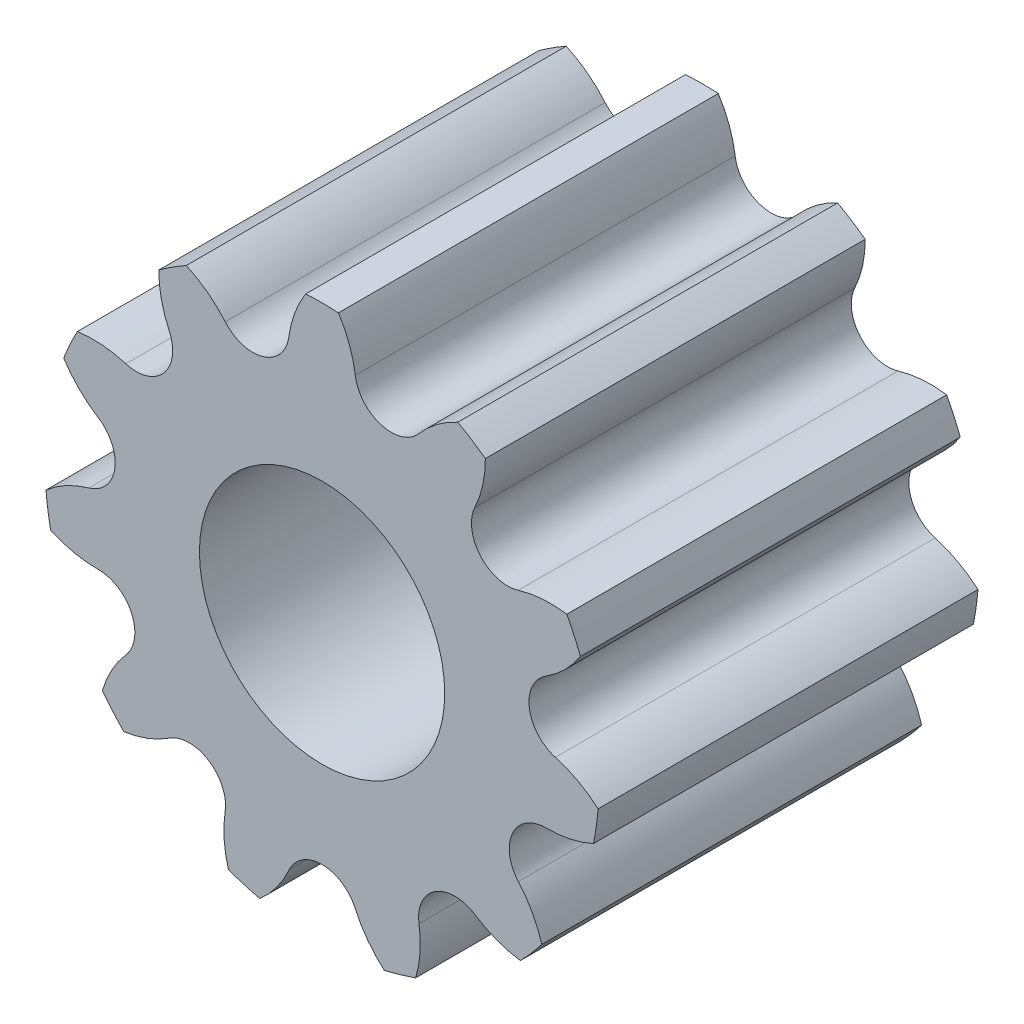
from build123d import *

# Parameters (mm, degrees)
SKETCH1_R           = 1.55
BOSS_EXTRUDE1_DEPTH = 4.8


with BuildPart() as part:
    # Sketch1 → Boss-Extrude1 (new body)
    with BuildSketch(Plane.XY):
        with BuildLine():
            ThreePointArc((-1.220475879, -2.635924597), (-1.222210326, -2.658421079), (-1.225048855, -2.680805064))
            ThreePointArc((-1.225048855, -2.680805064), (-1.237827813, -2.990086384), (-1.183146697, -3.294763611))
            ThreePointArc((-1.183146697, -3.294763611), (-0.986277373, -3.358952263), (-0.785957353, -3.411388925))
            ThreePointArc((-0.785957353, -3.411388925), (-0.575235727, -3.184640974), (-0.418775964, -2.917548145))
            ThreePointArc((-0.418775964, -2.917548145), (-0.409062191, -2.897182914), (-0.398358784, -2.877319956))
            ThreePointArc((-0.398358784, -2.877319956), (0, -2.646063949), (0.398358784, -2.877319957))
            ThreePointArc((0.398358784, -2.877319957), (0.409062191, -2.897182914), (0.418775964, -2.917548145))
            ThreePointArc((0.418775964, -2.917548145), (0.575235727, -3.184640974), (0.785957353, -3.411388925))
            ThreePointArc((0.785957353, -3.411388925), (0.986277373, -3.358952263), (1.183146697, -3.294763611))
            ThreePointArc((1.183146697, -3.294763611), (1.237827812, -2.990086385), (1.225048855, -2.680805065))
            ThreePointArc((1.225048855, -2.680805065), (1.222210326, -2.65842108), (1.220475879, -2.635924598))
            ThreePointArc((1.220475879, -2.635924598), (1.430570178, -2.226010644), (1.890717351, -2.205186558))
            ThreePointArc((1.890717351, -2.205186558), (1.910460355, -2.216109643), (1.929642376, -2.227990303))
            ThreePointArc((1.929642376, -2.227990303), (2.205665989, -2.368094556), (2.505525497, -2.444922359))
            ThreePointArc((2.505525497, -2.444922359), (2.645696022, -2.292508653), (2.776610031, -2.13207413))
            ThreePointArc((2.776610031, -2.13207413), (2.657889767, -1.846200494), (2.479929318, -1.592925316))
            ThreePointArc((2.479929318, -1.592925316), (2.4654397, -1.575629335), (2.451818074, -1.557641803))
            ThreePointArc((2.451818074, -1.557641803), (2.40694443, -1.09921469), (2.782786513, -0.832922011))
            ThreePointArc((2.782786513, -0.832922011), (2.80530085, -0.831437221), (2.827860963, -0.831061285))
            ThreePointArc((2.827860963, -0.831061285), (3.135812881, -0.79969485), (3.429606999, -0.702210219))
            ThreePointArc((3.429606999, -0.702210219), (3.465124877, -0.498209743), (3.488519299, -0.292466177))
            ThreePointArc((3.488519299, -0.292466177), (3.234090501, -0.116158991), (2.947449745, 0.000696964))
            ThreePointArc((2.947449745, 0.000696964), (2.925909389, 0.00741359), (2.904725354, 0.015181258))
            ThreePointArc((2.904725354, 0.015181258), (2.619130834, 0.376574163), (2.791340622, 0.80378939))
            ThreePointArc((2.791340622, 0.80378939), (2.80947815, 0.817210645), (2.828253678, 0.829723821))
            ThreePointArc((2.828253678, 0.829723821), (3.070361342, 1.022602322), (3.264812511, 1.263448704))
            ThreePointArc((3.264812511, 1.263448704), (3.184401067, 1.454267239), (3.092848337, 1.63999772))
            ThreePointArc((3.092848337, 1.63999772), (2.783490351, 1.65076217), (2.479175704, 1.594097963))
            ThreePointArc((2.479175704, 1.594097963), (2.457423521, 1.588102753), (2.435402858, 1.583184377))
            ThreePointArc((2.435402858, 1.583184377), (1.999761704, 1.73280338), (1.913663807, 2.18530334))
            ThreePointArc((1.913663807, 2.18530334), (1.921665988, 2.206399906), (1.930695833, 2.227077476))
            ThreePointArc((1.930695833, 2.227077476), (2.030091771, 2.520230481), (2.063463119, 2.82797159))
            ThreePointArc((2.063463119, 2.82797159), (1.892652419, 2.945024649), (1.715219882, 3.051773929))
            ThreePointArc((1.715219882, 3.051773929), (1.449151682, 2.893578006), (1.223780893, 2.681384122))
            ThreePointArc((1.223780893, 2.681384122), (1.208723048, 2.664580512), (1.192857163, 2.648537642))
            ThreePointArc((1.192857163, 2.648537642), (0.745482362, 2.538879767), (0.428412254, 2.87299892))
            ThreePointArc((0.428412254, 2.87299892), (0.423738452, 2.895072786), (0.420155704, 2.917349768))
            ThreePointArc((0.420155704, 2.917349768), (0.345282406, 3.217703271), (0.206978766, 3.494633479))
            ThreePointArc((0.206978766, 3.494633479), (0.103534673, 3.499226191), (0, 3.500757541))
            ThreePointArc((0, 3.500757541), (-0.103534673, 3.499226191), (-0.206978766, 3.494633479))
            ThreePointArc((-0.206978766, 3.494633479), (-0.345282406, 3.217703271), (-0.420155704, 2.917349768))
            ThreePointArc((-0.420155704, 2.917349768), (-0.423738452, 2.895072786), (-0.428412254, 2.87299892))
            ThreePointArc((-0.428412254, 2.87299892), (-0.745482362, 2.538879767), (-1.192857163, 2.648537642))
            ThreePointArc((-1.192857163, 2.648537642), (-1.208723048, 2.664580512), (-1.223780893, 2.681384122))
            ThreePointArc((-1.223780893, 2.681384122), (-1.449151682, 2.893578006), (-1.715219882, 3.051773929))
            ThreePointArc((-1.715219882, 3.051773929), (-1.892652419, 2.945024649), (-2.063463119, 2.82797159))
            ThreePointArc((-2.063463119, 2.82797159), (-2.030091771, 2.520230481), (-1.930695833, 2.227077476))
            ThreePointArc((-1.930695833, 2.227077476), (-1.921665988, 2.206399906), (-1.913663807, 2.18530334))
            ThreePointArc((-1.913663807, 2.18530334), (-1.999761704, 1.73280338), (-2.435402858, 1.583184377))
            ThreePointArc((-2.435402858, 1.583184377), (-2.457423521, 1.588102753), (-2.479175704, 1.594097963))
            ThreePointArc((-2.479175704, 1.594097963), (-2.783490351, 1.65076217), (-3.092848337, 1.63999772))
            ThreePointArc((-3.092848337, 1.63999772), (-3.184401067, 1.454267239), (-3.264812511, 1.263448704))
            ThreePointArc((-3.264812511, 1.263448704), (-3.070361342, 1.022602322), (-2.828253678, 0.829723821))
            ThreePointArc((-2.828253678, 0.829723821), (-2.80947815, 0.817210645), (-2.791340622, 0.80378939))
            ThreePointArc((-2.791340622, 0.80378939), (-2.619130834, 0.376574163), (-2.904725354, 0.015181258))
            ThreePointArc((-2.904725354, 0.015181258), (-2.925909389, 0.00741359), (-2.947449745, 0.000696964))
            ThreePointArc((-2.947449745, 0.000696964), (-3.234090501, -0.116158991), (-3.488519299, -0.292466177))
            ThreePointArc((-3.488519299, -0.292466177), (-3.465124877, -0.498209743), (-3.429606999, -0.702210219))
            ThreePointArc((-3.429606999, -0.702210219), (-3.135812881, -0.79969485), (-2.827860963, -0.831061285))
            ThreePointArc((-2.827860963, -0.831061285), (-2.80530085, -0.831437221), (-2.782786513, -0.832922011))
            ThreePointArc((-2.782786513, -0.832922011), (-2.40694443, -1.09921469), (-2.451818074, -1.557641803))
            ThreePointArc((-2.451818074, -1.557641803), (-2.4654397, -1.575629335), (-2.479929318, -1.592925316))
            ThreePointArc((-2.479929318, -1.592925316), (-2.657889767, -1.846200494), (-2.776610031, -2.13207413))
            ThreePointArc((-2.776610031, -2.13207413), (-2.645696022, -2.292508653), (-2.505525497, -2.444922359))
            ThreePointArc((-2.505525497, -2.444922359), (-2.205665987, -2.368094557), (-1.929642373, -2.227990304))
            ThreePointArc((-1.929642373, -2.227990304), (-1.910460352, -2.216109645), (-1.890717348, -2.20518656))
            ThreePointArc((-1.890717348, -2.20518656), (-1.430570177, -2.226010646), (-1.220475879, -2.635924597))
        make_face()
        Circle(SKETCH1_R, mode=Mode.SUBTRACT)
    extrude(amount=BOSS_EXTRUDE1_DEPTH)


solid = part.part
